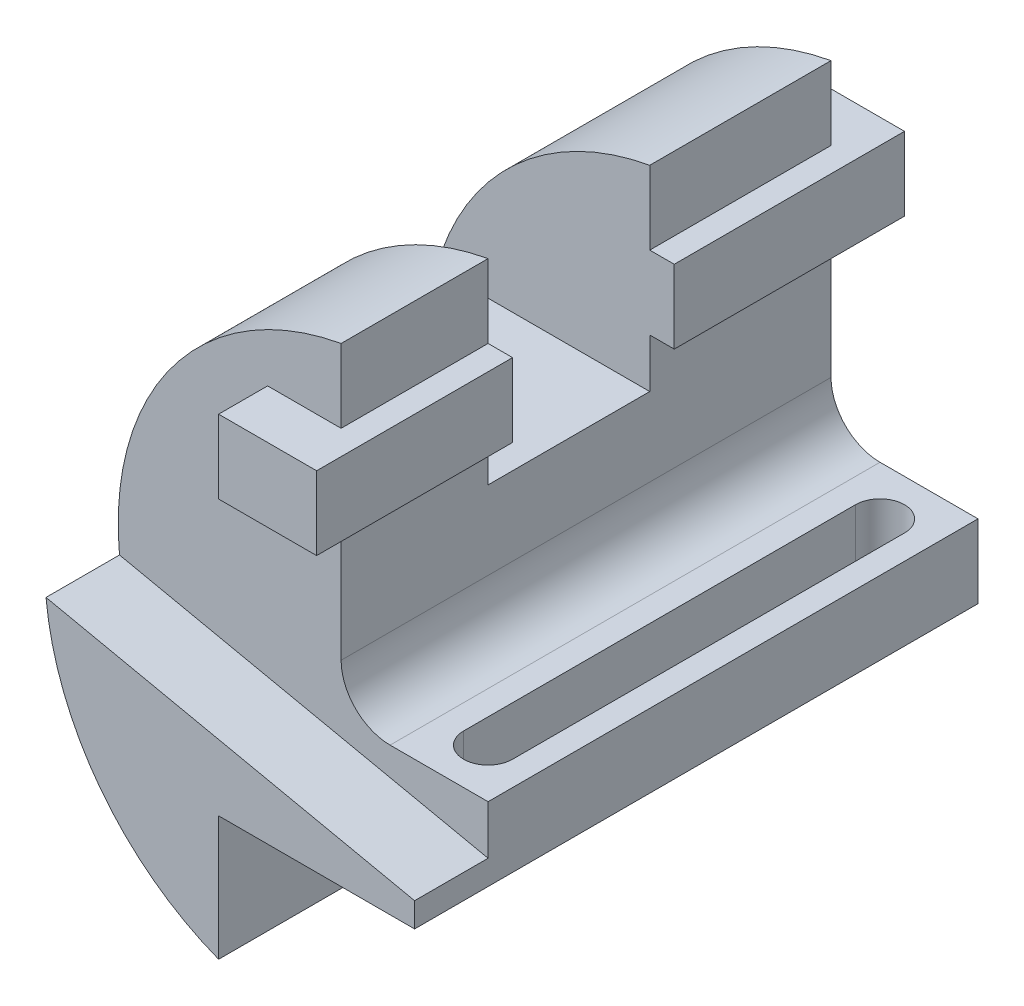
from build123d import *

# Parameters (mm, degrees)
BOSS_EXTRUDE2_DEPTH      = 115
CUT_EXTRUDE1_START       = -15
CUT_EXTRUDE1_DEPTH       = 15
BOSS_EXTRUDE4_DEPTH      = 10
BOSS_EXTRUDE4_DEPTH_BACK = 110
SKETCH4_W                = 20
SKETCH4_H                = 15
CUT_EXTRUDE3_DEPTH       = 148.83859442
CUT_EXTRUDE3_DEPTH_BACK  = 148.83859442
SKETCH5_W                = 33
SKETCH5_H                = 40
CUT_EXTRUDE4_DEPTH       = 153.581945197
CUT_EXTRUDE4_DEPTH_BACK  = 153.581945197
FILLET1_R                = 10


with BuildPart() as part:
    # Sketch1 → Boss-Extrude2 (new body)
    with BuildSketch(Plane.XY):
        with BuildLine():
            Line((0, 0), (0, 15))
            Line((0, 15), (-30, 15))
            Line((-30, 15), (-30, 81))
            ThreePointArc((-30, 81), (-75.256322222, 31.603413808), (-40, -25.362796982))
            Line((-40, -25.362796982), (-40, 0))
            Line((-40, 0), (0, 0))
        make_face()
    extrude(amount=BOSS_EXTRUDE2_DEPTH)

    # Sketch2 → Cut-Extrude1 (cut)
    with BuildSketch(Plane.XY.offset(115).offset(CUT_EXTRUDE1_START)):
        with BuildLine():
            Line((0, 5), (-75.235044142, 20.9917023))
            ThreePointArc((-75.235044142, 20.9917023), (-64.318751046, 59.816391467), (-30, 81))
            Line((-30, 81), (-30, 15))
            Line((-30, 15), (0, 15))
            Line((0, 15), (0, 5))
        make_face()
    extrude(amount=CUT_EXTRUDE1_DEPTH, mode=Mode.SUBTRACT)

    # Sketch4 → Boss-Extrude4 (add, two sides: drawn at the far end of the back side and taken through both)
    with BuildSketch(Plane(origin=(0, 0, 0), x_dir=(-1, 0, 0), z_dir=(0, 0, -1)).offset(-BOSS_EXTRUDE4_DEPTH_BACK)):
        with Locations((35, 58.5)):
            Rectangle(SKETCH4_W, SKETCH4_H)
    extrude(amount=BOSS_EXTRUDE4_DEPTH + BOSS_EXTRUDE4_DEPTH_BACK)

    # Sketch5 → Cut-Extrude3 (cut, two sides: drawn at the far end of the back side and taken through both)
    with BuildSketch(Plane(origin=(-30, 0, 0), x_dir=(0, 0, -1), z_dir=(1, 0, 0)).offset(-CUT_EXTRUDE3_DEPTH_BACK)):
        with Locations((-53.5, 61)):
            Rectangle(SKETCH5_W, SKETCH5_H)
    extrude(amount=CUT_EXTRUDE3_DEPTH + CUT_EXTRUDE3_DEPTH_BACK, mode=Mode.SUBTRACT)

    # Sketch6 → Cut-Extrude4 (cut, two sides: drawn at the far end of the back side and taken through both)
    with BuildSketch(Plane(origin=(0, 15, 0), x_dir=(1, 0, 0), z_dir=(0, 1, 0)).offset(-CUT_EXTRUDE4_DEPTH_BACK)):
        with BuildLine():
            Line((-5, -10), (-5, -90))
            ThreePointArc((-5, -90), (-10, -95), (-15, -90))
            Line((-15, -90), (-15, -10))
            ThreePointArc((-15, -10), (-10, -5), (-5, -10))
        make_face()
    extrude(amount=CUT_EXTRUDE4_DEPTH + CUT_EXTRUDE4_DEPTH_BACK, mode=Mode.SUBTRACT)

    # Fillet1
    fillet1_edges = [part.edges().sort_by_distance(p)[0] for p in [
        (-30, 15, 50),
    ]]
    fillet(fillet1_edges, radius=FILLET1_R)


solid = part.part
